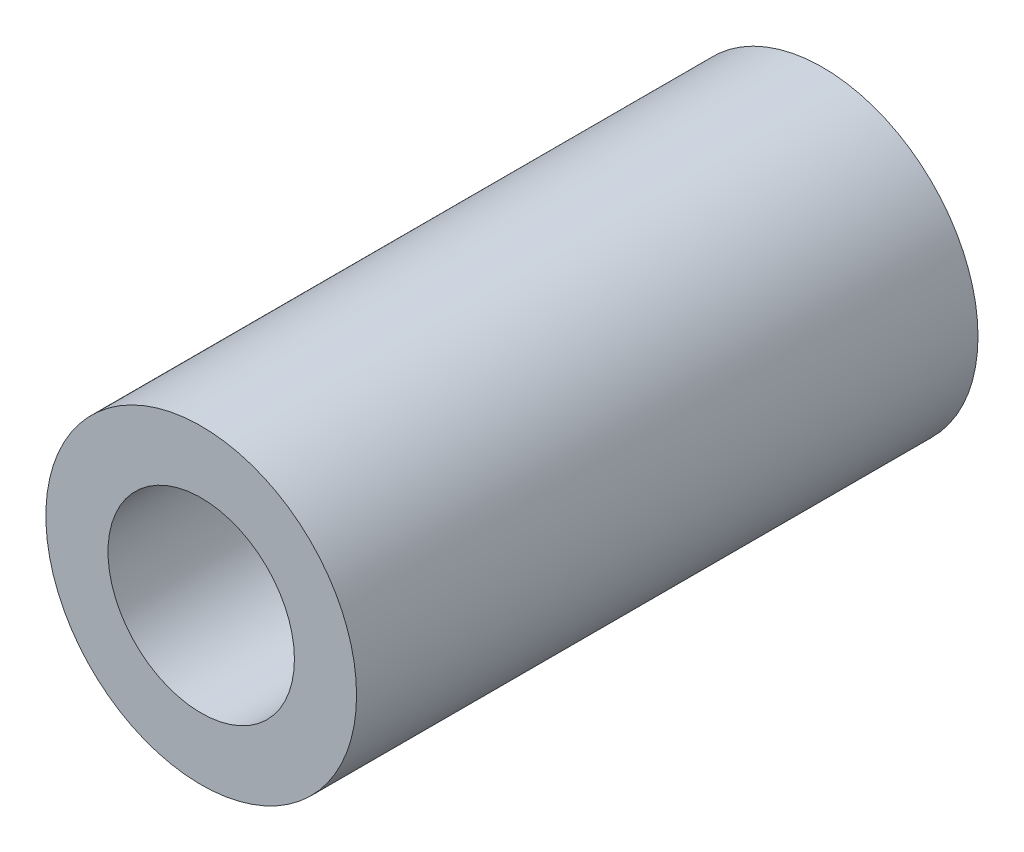
from build123d import *

# Parameters (mm, degrees)
SKETCH5_R           = 2.5
BOSS_EXTRUDE2_DEPTH = 10
SKETCH6_R           = 1.5
CUT_EXTRUDE1_DEPTH  = 10


with BuildPart() as part:
    # Sketch5 → Boss-Extrude2 (new body)
    with BuildSketch(Plane.XY):
        Circle(SKETCH5_R)
    extrude(amount=BOSS_EXTRUDE2_DEPTH)

    # Sketch6 → Cut-Extrude1 (cut)
    with BuildSketch(Plane.XY.offset(10)):
        Circle(SKETCH6_R)
    extrude(amount=-CUT_EXTRUDE1_DEPTH, mode=Mode.SUBTRACT)


solid = part.part
